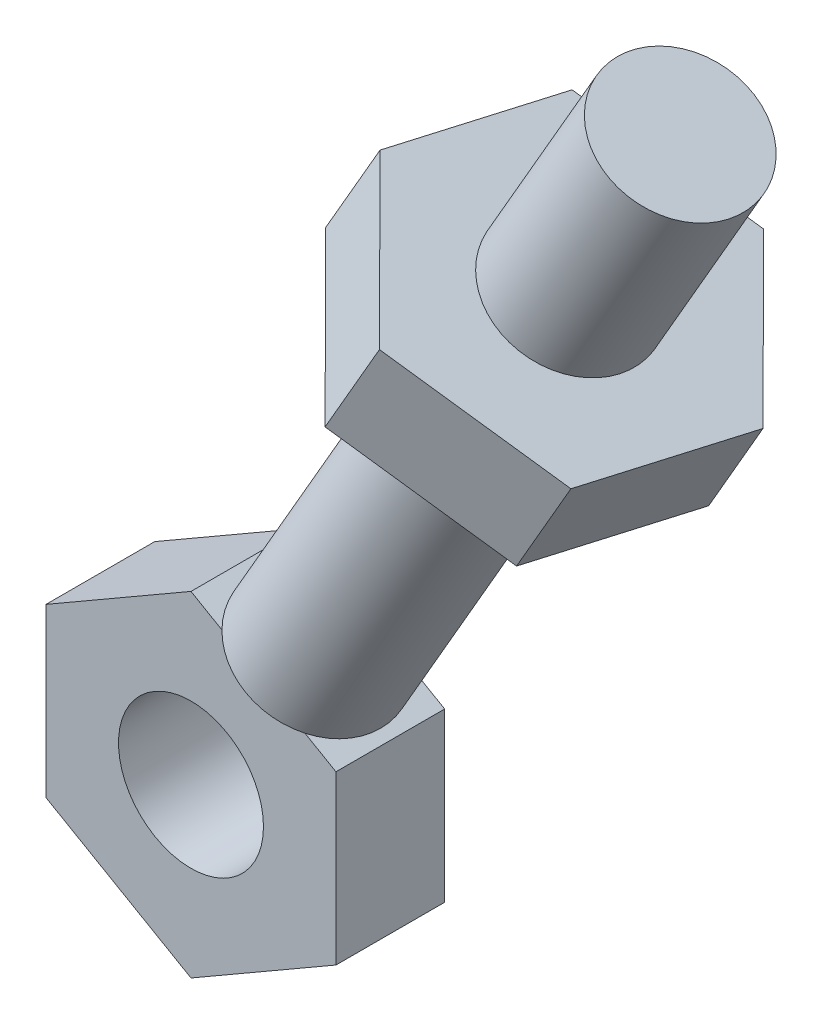
from build123d import *

# Parameters (mm, degrees)
SKETCH2_R           = 2
BOSS_EXTRUDE2_DEPTH = 3
SKETCH3_R           = 2
BOSS_EXTRUDE3_DEPTH = 20
BOSS_EXTRUDE4_DEPTH = 3


with BuildPart() as part:
    # Sketch2 → Boss-Extrude2 (new body)
    with BuildSketch(Plane.XY):
        Polygon((0, 4.618802154), (-4, 2.309401077), (-4, -2.309401077), (0, -4.618802154), (4, -2.309401077), (4, 2.309401077), align=None)
        Circle(SKETCH2_R, mode=Mode.SUBTRACT)
    extrude(amount=BOSS_EXTRUDE2_DEPTH)

    # Sketch3 → Boss-Extrude3 (add)
    with BuildSketch(Plane(origin=(2, 3.464101615, 0), x_dir=(0.8660254037844386, -0.4999999999999999, 0), z_dir=(0.49999999999999994, 0.8660254037844387, 0))):
        with Locations(Location((0, -1.5, 0), (0, 0, 48.590377891))):
            Circle(SKETCH3_R)
    extrude(amount=BOSS_EXTRUDE3_DEPTH)

    # Sketch4 → Boss-Extrude4 (add)
    with BuildSketch(Plane(origin=(7.5, 12.990381057, 0), x_dir=(0.8660254037844386, -0.4999999999999999, 0), z_dir=(0.49999999999999994, 0.8660254037844387, 0))):
        Polygon((0.885290866, 3.033165937), (-3.483191429, 1.533267348), (-4.368482294, -2.999898589), (-0.885290866, -6.033165937), (3.483191429, -4.533267348), (4.368482294, -0.000101411), align=None)
    extrude(amount=BOSS_EXTRUDE4_DEPTH)


solid = part.part
